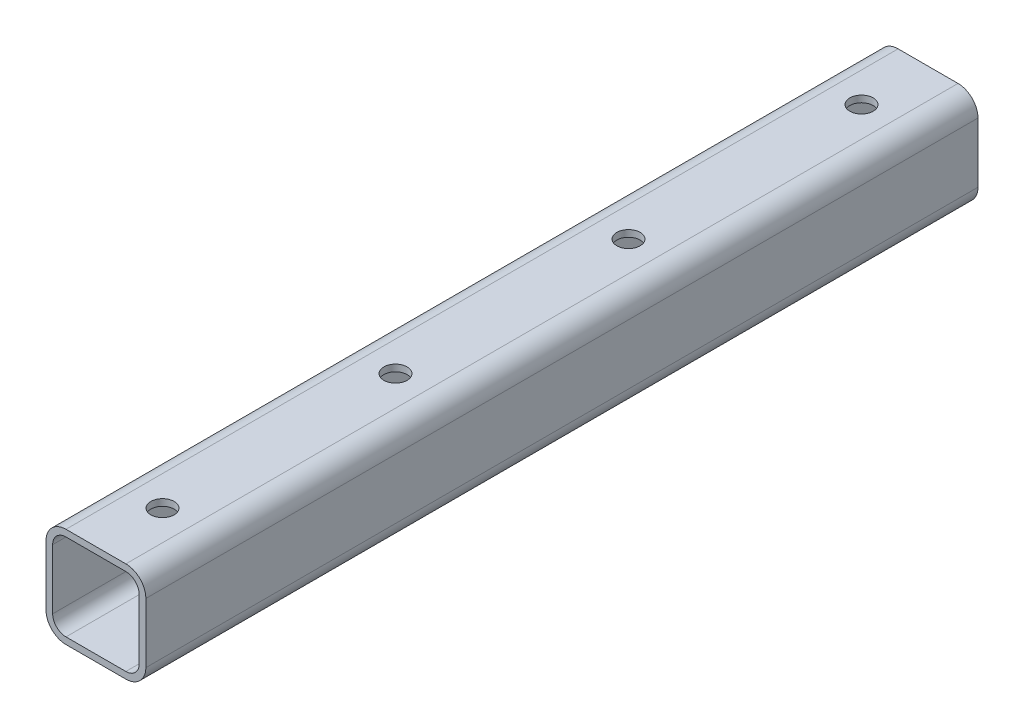
from build123d import *

# Parameters (mm, degrees)
AUFSATZ_LINEAR_AUSTRAGEN1_DEPTH = 125
SKIZZE2_R                       = 3.5
SCHNITT_LINEAR_AUSTRAGEN1_DEPTH = 60


with BuildPart() as part:
    # Skizze1 → Aufsatz-Linear austragen1 (new, symmetric)
    with BuildSketch(Plane.XY):
        with BuildLine():
            Line((-9, 15), (9, 15))
            ThreePointArc((9, 15), (13.242640687, 13.242640687), (15, 9))
            Line((15, 9), (15, -9))
            ThreePointArc((15, -9), (13.242640687, -13.242640687), (9, -15))
            Line((9, -15), (-9, -15))
            ThreePointArc((-9, -15), (-13.242640687, -13.242640687), (-15, -9))
            Line((-15, -9), (-15, 9))
            ThreePointArc((-15, 9), (-13.242640687, 13.242640687), (-9, 15))
        make_face()
        with BuildLine():
            Line((-13, 9), (-13, -9))
            ThreePointArc((-13, -9), (-11.828427125, -11.828427125), (-9, -13))
            Line((-9, -13), (9, -13))
            ThreePointArc((9, -13), (11.828427125, -11.828427125), (13, -9))
            Line((13, -9), (13, 9))
            ThreePointArc((13, 9), (11.828427125, 11.828427125), (9, 13))
            Line((9, 13), (-9, 13))
            ThreePointArc((-9, 13), (-11.828427125, 11.828427125), (-13, 9))
        make_face(mode=Mode.SUBTRACT)
    extrude(amount=AUFSATZ_LINEAR_AUSTRAGEN1_DEPTH, both=True)

    # Skizze2 → Schnitt-Linear austragen1 (cut)
    with BuildSketch(Plane(origin=(0, 15, 0), x_dir=(1, 0, 0), z_dir=(0, 1, 0))):
        with Locations(Location((0, 105, 0), (0, 0, 270))):
            Circle(SKIZZE2_R)
        with Locations(Location((0, 35, 0), (0, 0, 270))):
            Circle(SKIZZE2_R)
        with Locations((0, -35)):
            Circle(SKIZZE2_R)
        with Locations((0, -105)):
            Circle(SKIZZE2_R)
    extrude(amount=-SCHNITT_LINEAR_AUSTRAGEN1_DEPTH, mode=Mode.SUBTRACT)


solid = part.part
